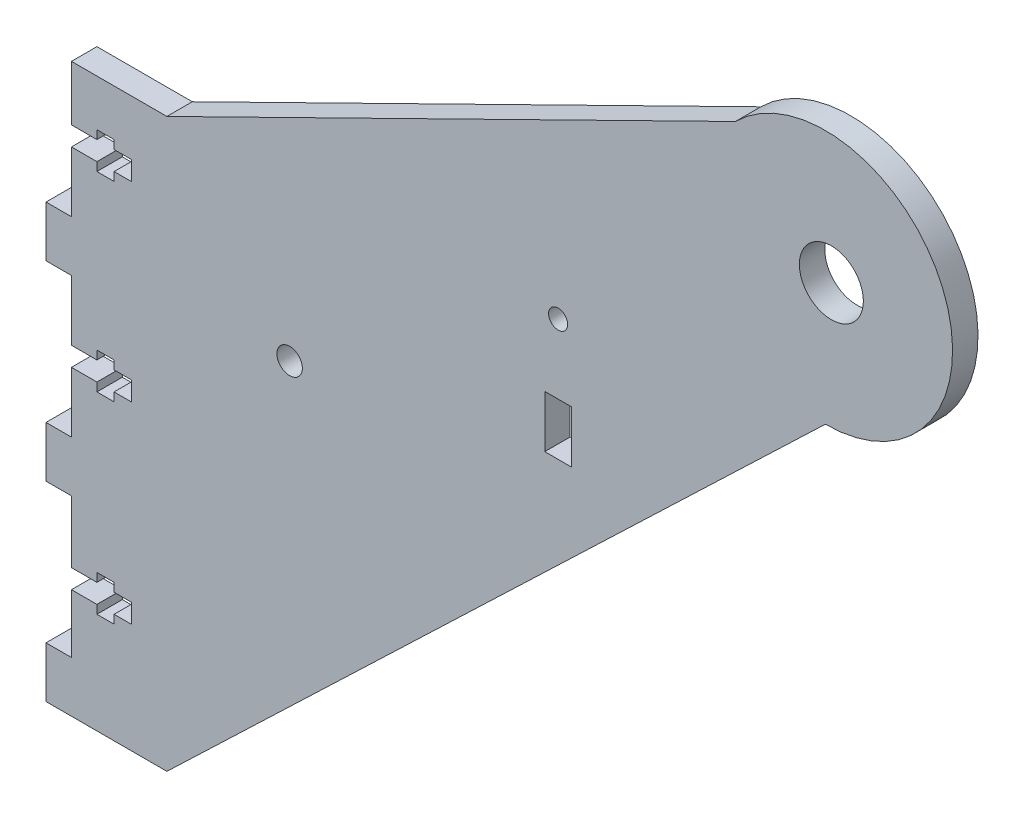
from build123d import *

# Parameters (mm, degrees)
SKETCH_1_R      = 2
SKETCH_1_W      = 4.2
SKETCH_1_H      = 8.2
SKETCH_1_R_2    = 1.5
SKETCH_1_R_3    = 5.03
EXTRUDE_1_DEPTH = 4


with BuildPart() as part:
    # 草图1 → 凸台-拉伸1 (new body)
    with BuildSketch(Plane.XY):
        with BuildLine():
            Line((0.838796757, -22.113571429), (-3.161203243, -22.113571429))
            Line((-3.161203243, -22.113571429), (-3.161203243, -31.344407284))
            Line((-3.161203243, -31.344407284), (-7.161203243, -31.344407284))
            Line((-7.161203243, -31.344407284), (-7.161203243, -39.344407284))
            Line((-7.161203243, -39.344407284), (-3.161203243, -39.344407284))
            Line((-3.161203243, -39.344407284), (11.838796757, -39.344407284))
            Line((11.838796757, -39.344407284), (115.338796757, 59.655592716))
            ThreePointArc((115.338796757, 59.655592716), (133.816387407, 87.309261363), (101.196661133, 93.797728339))
            Line((101.196661133, 93.797728339), (11.838796757, 49.807248516))
            Line((11.838796757, 49.807248516), (-3.161203243, 49.807248516))
            Line((-3.161203243, 49.807248516), (-3.161203243, 41.155592716))
            Line((-3.161203243, 41.155592716), (0.838796757, 41.155592716))
            Line((0.838796757, 41.155592716), (0.838796757, 42.505592716))
            Line((0.838796757, 42.505592716), (3.538796757, 42.505592716))
            Line((3.538796757, 42.505592716), (3.538796757, 41.155592716))
            Line((3.538796757, 41.155592716), (6.238796757, 41.155592716))
            Line((6.238796757, 41.155592716), (6.238796757, 38.155592716))
            Line((6.238796757, 38.155592716), (3.538796757, 38.155592716))
            Line((3.538796757, 38.155592716), (3.538796757, 36.805592716))
            Line((3.538796757, 36.805592716), (0.838796757, 36.805592716))
            Line((0.838796757, 36.805592716), (0.838796757, 38.155592716))
            Line((0.838796757, 38.155592716), (-3.161203243, 38.155592716))
            Line((-3.161203243, 38.155592716), (-3.161203243, 28.655592716))
            Line((-3.161203243, 28.655592716), (-7.161203243, 28.655592716))
            Line((-7.161203243, 28.655592716), (-7.161203243, 20.655592716))
            Line((-7.161203243, 20.655592716), (-3.161203243, 20.655592716))
            Line((-3.161203243, 20.655592716), (-3.161203243, 11.155592716))
            Line((-3.161203243, 11.155592716), (0.838796757, 11.155592716))
            Line((0.838796757, 11.155592716), (0.838796757, 12.505592716))
            Line((0.838796757, 12.505592716), (3.538796757, 12.505592716))
            Line((3.538796757, 12.505592716), (3.538796757, 11.155592716))
            Line((3.538796757, 11.155592716), (6.238796757, 11.155592716))
            Line((6.238796757, 11.155592716), (6.238796757, 8.155592716))
            Line((6.238796757, 8.155592716), (3.538796757, 8.155592716))
            Line((3.538796757, 8.155592716), (3.538796757, 6.805592716))
            Line((3.538796757, 6.805592716), (0.838796757, 6.805592716))
            Line((0.838796757, 6.805592716), (0.838796757, 8.155592716))
            Line((0.838796757, 8.155592716), (-3.161203243, 8.155592716))
            Line((-3.161203243, 8.155592716), (-3.161203243, -1.344407284))
            Line((-3.161203243, -1.344407284), (-7.161203243, -1.344407284))
            Line((-7.161203243, -1.344407284), (-7.161203243, -9.344407284))
            Line((-7.161203243, -9.344407284), (-3.161203243, -9.344407284))
            Line((-3.161203243, -9.344407284), (-3.161203243, -19.113571429))
            Line((-3.161203243, -19.113571429), (0.838796757, -19.113571429))
            Line((0.838796757, -19.113571429), (0.838796757, -17.763571429))
            Line((0.838796757, -17.763571429), (3.538796757, -17.763571429))
            Line((3.538796757, -17.763571429), (3.538796757, -19.113571429))
            Line((3.538796757, -19.113571429), (6.238796757, -19.113571429))
            Line((6.238796757, -19.113571429), (6.238796757, -22.113571429))
            Line((6.238796757, -22.113571429), (3.538796757, -22.113571429))
            Line((3.538796757, -22.113571429), (3.538796757, -23.463571429))
            Line((3.538796757, -23.463571429), (0.838796757, -23.463571429))
            Line((0.838796757, -23.463571429), (0.838796757, -22.113571429))
        make_face()
        with Locations((31.133984923, 26.166524095)):
            Circle(SKETCH_1_R, mode=Mode.SUBTRACT)
        with Locations((73.338796757, 37.976109285)):
            Rectangle(SKETCH_1_W, SKETCH_1_H, mode=Mode.SUBTRACT)
        with Locations((73.338796757, 52.976109285)):
            Circle(SKETCH_1_R_2, mode=Mode.SUBTRACT)
        with Locations((116.282857143, 79.386428571)):
            Circle(SKETCH_1_R_3, mode=Mode.SUBTRACT)
    extrude(amount=EXTRUDE_1_DEPTH)


solid = part.part
